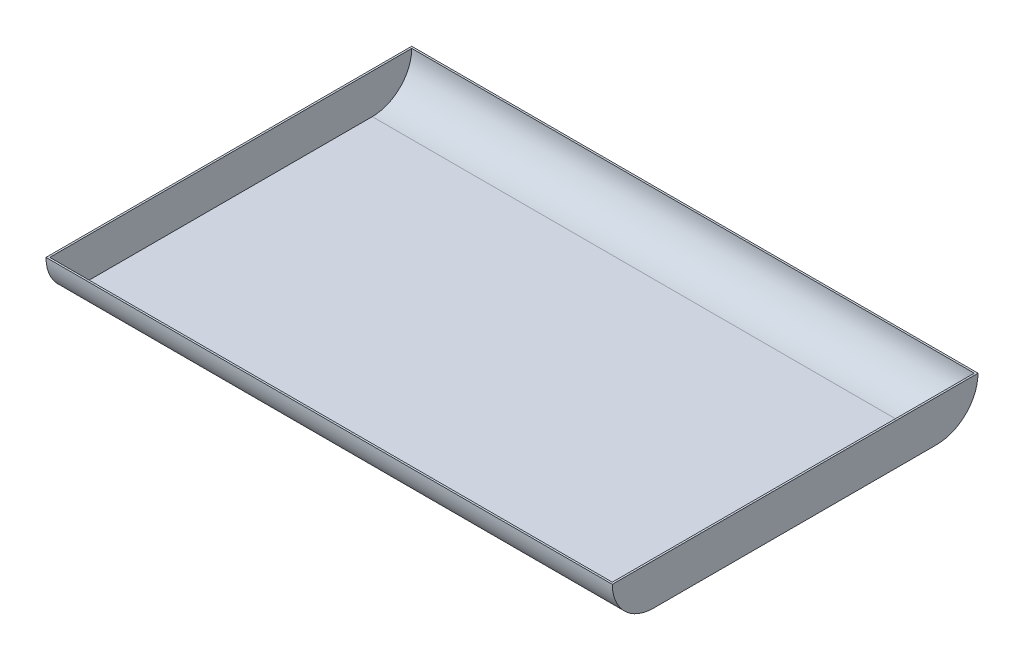
from build123d import *

# Parameters (mm, degrees)
BOSS_EXTRUDE1_DEPTH      = 304.8
BOSS_EXTRUDE1_DEPTH_BACK = 304.8
SHELL1_T                 = -2


with BuildPart() as part:
    # Sketch1 → Boss-Extrude1 (new, two sides: drawn at the far end of the back side and taken through both)
    with BuildSketch(Plane(origin=(0, 0, 0), x_dir=(0, 0, -1), z_dir=(1, 0, 0)).offset(-BOSS_EXTRUDE1_DEPTH_BACK)):
        with BuildLine():
            Line((-152.4, 0), (152.4, 0))
            ThreePointArc((152.4, 0), (183.830896424, 13.019103576), (196.85, 44.45))
            Line((196.85, 44.45), (-196.85, 44.45))
            ThreePointArc((-196.85, 44.45), (-183.830896424, 13.019103576), (-152.4, 0))
        make_face()
    extrude(amount=BOSS_EXTRUDE1_DEPTH + BOSS_EXTRUDE1_DEPTH_BACK)

    # Shell1
    shell1_openings = [part.faces().sort_by_distance(p)[0] for p in [
        (0, 44.45, 0),
    ]]
    offset(amount=SHELL1_T, openings=shell1_openings, kind=Kind.INTERSECTION)


solid = part.part
